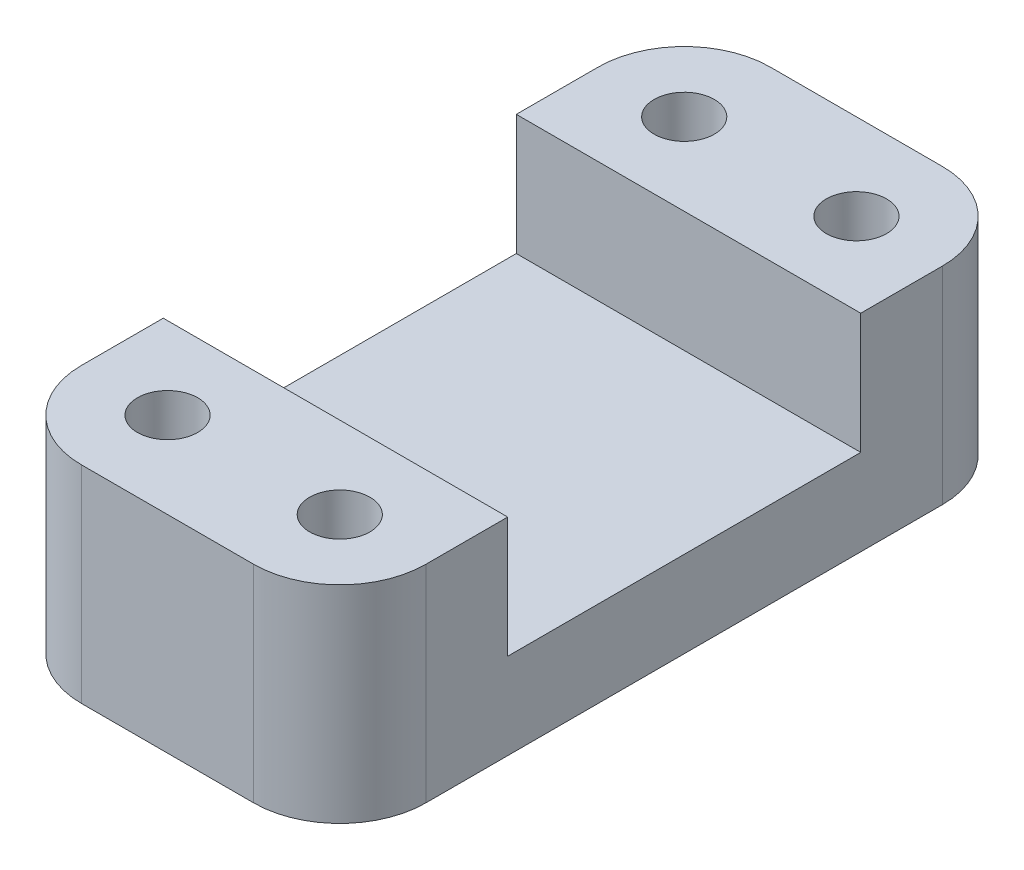
from build123d import *

# Parameters (mm, degrees)
SKETCH1_W                                           = 20
SKETCH1_H                                           = 40
BOSS_EXTRUDE1_DEPTH                                 = 5
SKETCH2_W                                           = 20
SKETCH2_H                                           = 9.75
BOSS_EXTRUDE2_DEPTH                                 = 7
SKETCH3_R                                           = 1.75
CUT_EXTRUDE1_DEPTH                                  = 26.377155081
CBORE_FOR_M3_HEX_SOCKET_HEAD_CAP_SCREW1_D           = 3.4
CBORE_FOR_M3_HEX_SOCKET_HEAD_CAP_SCREW1_CBORE_D     = 6.5
CBORE_FOR_M3_HEX_SOCKET_HEAD_CAP_SCREW1_CBORE_DEPTH = 3.4
FILLET1_R                                           = 5


with BuildPart() as part:
    # Sketch1 → Boss-Extrude1 (new body)
    with BuildSketch(Plane(origin=(0, 0, 0), x_dir=(1, 0, 0), z_dir=(0, 1, 0))):
        Rectangle(SKETCH1_W, SKETCH1_H)
    extrude(amount=BOSS_EXTRUDE1_DEPTH)

    # Sketch2 → Boss-Extrude2 (add)
    with BuildSketch(Plane(origin=(0, 5, 0), x_dir=(1, 0, 0), z_dir=(0, 1, 0))):
        with Locations((0, -15.125)):
            Rectangle(SKETCH2_W, SKETCH2_H)
        with Locations((0, 15.125)):
            Rectangle(SKETCH2_W, SKETCH2_H)
    extrude(amount=BOSS_EXTRUDE2_DEPTH)

    # Sketch3 → Cut-Extrude1 (cut, through all)
    with BuildSketch(Plane.XZ):
        with Locations(Location((5, 15, 0), (0, 0, 270))):
            Circle(SKETCH3_R)
        with Locations(Location((-5, 15, 0), (0, 0, 270))):
            Circle(SKETCH3_R)
        with Locations(Location((-5, -15, 0), (0, 0, 270))):
            Circle(SKETCH3_R)
        with Locations(Location((5, -15, 0), (0, 0, 270))):
            Circle(SKETCH3_R)
    extrude(amount=-CUT_EXTRUDE1_DEPTH, mode=Mode.SUBTRACT)

    # CBORE for M3 Hex Socket Head Cap Screw1 (through all)
    with Locations(Plane(origin=(0, 0, 0), x_dir=(-1, 0, 0), z_dir=(0, -1, 0))):
        with Locations((-5, -15), (5, -15), (5, 15), (-5, 15)):
            CounterBoreHole(CBORE_FOR_M3_HEX_SOCKET_HEAD_CAP_SCREW1_D / 2, CBORE_FOR_M3_HEX_SOCKET_HEAD_CAP_SCREW1_CBORE_D / 2, CBORE_FOR_M3_HEX_SOCKET_HEAD_CAP_SCREW1_CBORE_DEPTH)

    # Fillet1
    fillet1_edges = [part.edges().sort_by_distance(p)[0] for p in [
        (10, 6, 20),
        (-10, 6, 20),
        (-10, 6, -20),
        (10, 6, -20),
    ]]
    fillet(fillet1_edges, radius=FILLET1_R)


solid = part.part
